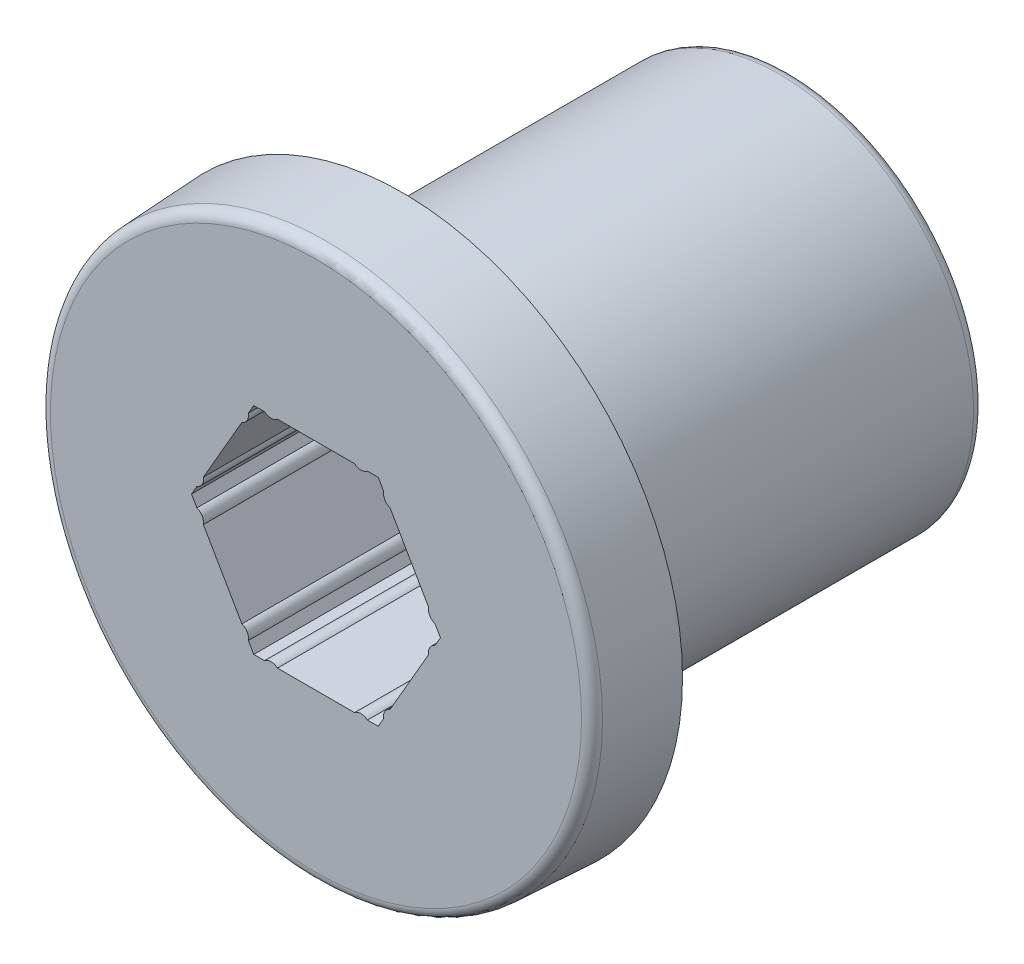
from build123d import *

# Parameters (mm, degrees)
SKETCH2_R           = 4.5
BOSS_EXTRUDE1_DEPTH = 9
CUT_EXTRUDE1_DEPTH  = 15.335271187
FILLET1_R           = 0.25


with BuildPart() as part:
    # Sketch1 → Revolve1 (revolve)
    with BuildSketch(Plane(origin=(0, 0, 0), x_dir=(1, 0, 0), z_dir=(0, 1, 0))):
        Polygon((6.5, 0), (0, 0), (0, -2), (6.395184442, -2), align=None)
    revolve(axis=Axis((0, 0, 0), (0, 0, 1)))

    # Sketch2 → Boss-Extrude1 (add)
    with BuildSketch(Plane(origin=(0, 0, 0), x_dir=(-1, 0, 0), z_dir=(0, 0, -1))):
        with Locations(Location((0, 0, 0), (0, 0, 90))):
            Circle(SKETCH2_R)
    extrude(amount=BOSS_EXTRUDE1_DEPTH)

    # Sketch3 → Cut-Extrude1 (cut, through all)
    with BuildSketch(Plane(origin=(0, 0, -9), x_dir=(-1, 0, 0), z_dir=(0, 0, -1))):
        with BuildLine():
            Line((1.193375673, -2.5), (1.443375673, -2.5))
            Line((1.443375673, -2.5), (1.568375673, -2.283493649))
            ThreePointArc((1.568375673, -2.283493649), (1.595744276, -2.126089838), (1.718375673, -2.023686028))
            Line((1.718375673, -2.023686028), (2.611751346, -0.476313972))
            ThreePointArc((2.611751346, -0.476313972), (2.639119949, -0.318910162), (2.761751346, -0.216506351))
            Line((2.761751346, -0.216506351), (2.886751346, 0))
            Line((2.886751346, 0), (2.761751346, 0.216506351))
            ThreePointArc((2.761751346, 0.216506351), (2.639119949, 0.318910162), (2.611751346, 0.476313972))
            Line((2.611751346, 0.476313972), (1.718375673, 2.023686028))
            ThreePointArc((1.718375673, 2.023686028), (1.595744276, 2.126089838), (1.568375673, 2.283493649))
            Line((1.568375673, 2.283493649), (1.443375673, 2.5))
            Line((1.443375673, 2.5), (1.193375673, 2.5))
            ThreePointArc((1.193375673, 2.5), (1.043375673, 2.445), (0.893375673, 2.5))
            Line((0.893375673, 2.5), (-0.893375673, 2.5))
            ThreePointArc((-0.893375673, 2.5), (-1.043375673, 2.445), (-1.193375673, 2.5))
            Line((-1.193375673, 2.5), (-1.443375673, 2.5))
            Line((-1.443375673, 2.5), (-1.568375673, 2.283493649))
            ThreePointArc((-1.568375673, 2.283493649), (-1.595744276, 2.126089838), (-1.718375673, 2.023686028))
            Line((-1.718375673, 2.023686028), (-2.611751346, 0.476313972))
            ThreePointArc((-2.611751346, 0.476313972), (-2.639119949, 0.318910162), (-2.761751346, 0.216506351))
            Line((-2.761751346, 0.216506351), (-2.886751346, 0))
            Line((-2.886751346, 0), (-2.761751346, -0.216506351))
            ThreePointArc((-2.761751346, -0.216506351), (-2.639119949, -0.318910162), (-2.611751346, -0.476313972))
            Line((-2.611751346, -0.476313972), (-1.718375673, -2.023686028))
            ThreePointArc((-1.718375673, -2.023686028), (-1.595744276, -2.126089838), (-1.568375673, -2.283493649))
            Line((-1.568375673, -2.283493649), (-1.443375673, -2.5))
            Line((-1.443375673, -2.5), (-1.193375673, -2.5))
            ThreePointArc((-1.193375673, -2.5), (-1.043375673, -2.445), (-0.893375673, -2.5))
            Line((-0.893375673, -2.5), (0.893375673, -2.5))
            ThreePointArc((0.893375673, -2.5), (1.043375673, -2.445), (1.193375673, -2.5))
        make_face()
    extrude(amount=-CUT_EXTRUDE1_DEPTH, mode=Mode.SUBTRACT)

    # Fillet1
    fillet1_edges = [part.edges().sort_by_distance(p)[0] for p in [
        (-6.395184442, 0, 2),
        (0, -4.5, -9),
    ]]
    fillet(fillet1_edges, radius=FILLET1_R)


solid = part.part
